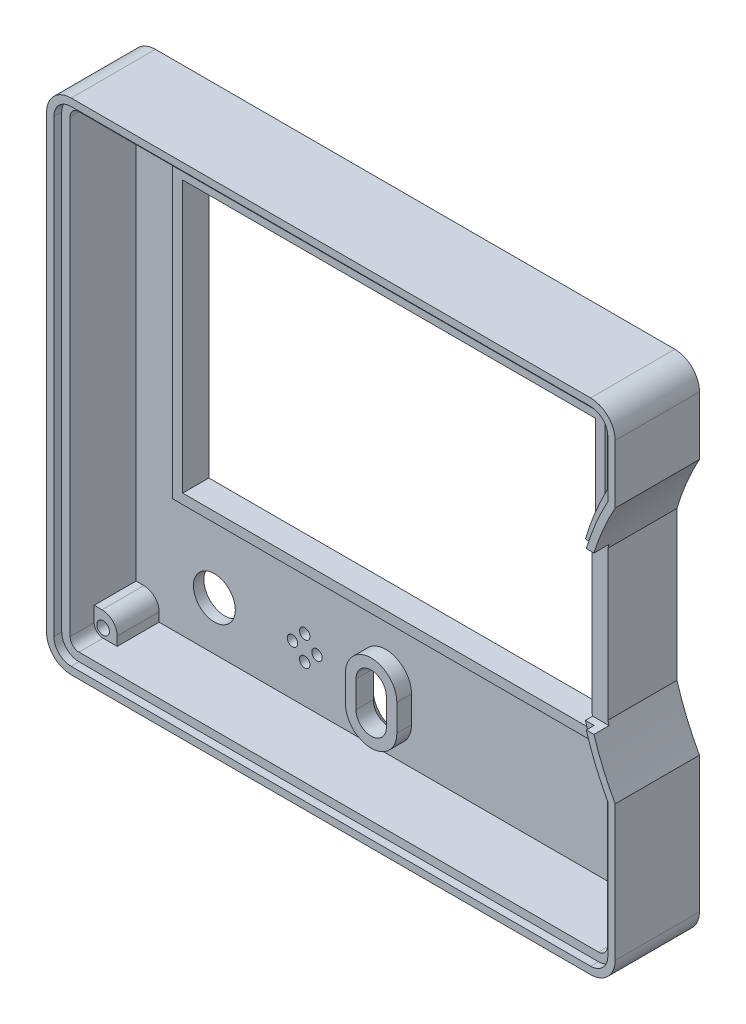
from build123d import *

# Parameters (mm, degrees)
SKETCH1_W                = 108.6
SKETCH1_H                = 95.4
BOSS_EXTRUDE1_DEPTH      = 16.1
CUT_EXTRUDE1_DEPTH       = 75.047214667
FILLET1_R                = 4.7
SHELL1_T                 = -3
SHELL1_THICKNESS_2_DEPTH = 1
CUT_EXTRUDE2_DEPTH       = 1.5
SKETCH4_W                = 78.8
SKETCH4_H                = 51.8
CUT_EXTRUDE3_DEPTH       = 74.63823735
SKETCH5_W                = 82.6
SKETCH5_H                = 55.6
SKETCH5_W_2              = 78.8
SKETCH5_H_2              = 51.8
BOSS_EXTRUDE2_DEPTH      = 3
SKETCH6_R                = 4
SKETCH6_R_2              = 1
CUT_EXTRUDE4_DEPTH       = 74.63823735
BOSS_EXTRUDE3_START      = 2.8
BOSS_EXTRUDE3_DEPTH      = 2.8
CHAMFER1_SIZE            = 1.5
CUT_EXTRUDE5_REACH       = 121.702
SKETCH8_W                = 2.9
SKETCH8_H                = 30
BOSS_EXTRUDE4_START      = 8
BOSS_EXTRUDE4_DEPTH      = 8
FILLET2_R                = 2.9
SKETCH10_R               = 1.21
CUT_EXTRUDE6_DEPTH       = 9


with BuildPart() as part:
    # Sketch1 → Boss-Extrude1 (new body)
    with BuildSketch(Plane.XY):
        Rectangle(SKETCH1_W, SKETCH1_H)
    extrude(amount=BOSS_EXTRUDE1_DEPTH)

    # Sketch2 → Cut-Extrude1 (cut, through all)
    with BuildSketch(Plane.XY.offset(16.1)):
        with BuildLine():
            Line((50.011, -6.861266451), (50.011, 21.582126451))
            ThreePointArc((50.011, 21.582126451), (148.66075, 7.36043), (50.011, -6.861266451))
        make_face()
    extrude(amount=-CUT_EXTRUDE1_DEPTH, mode=Mode.SUBTRACT)

    # Fillet1
    fillet1_edges = [part.edges().sort_by_distance(p)[0] for p in [
        (54.3, -47.7, 8.05),
        (-54.3, -47.7, 8.05),
        (-54.3, 47.7, 8.05),
        (54.3, 47.7, 8.05),
    ]]
    fillet(fillet1_edges, radius=FILLET1_R)

    # Shell1
    shell1_openings = [part.faces().sort_by_distance(p)[0] for p in [
        (-0.877010034, -0.123339484, 16.1),
    ]]
    offset(amount=SHELL1_T, openings=shell1_openings, kind=Kind.INTERSECTION)

    # Shell1 thickness 2 face (on inner face of the shell) → Shell1 thickness 2 (cut)
    with BuildSketch(Plane(origin=(-0.963593996, -0.143755332, 3), x_dir=(-1, 0, 0), z_dir=(0, 0, -1))):
        with BuildLine():
            Line((50.336406004, 43.143755332), (50.336406004, -42.856244668))
            ThreePointArc((50.336406004, -42.856244668), (49.838487532, -44.058326196), (48.636406004, -44.556244668))
            Line((48.636406004, -44.556244668), (-50.563593996, -44.556244668))
            ThreePointArc((-50.563593996, -44.556244668), (-51.765675524, -44.058326196), (-52.263593996, -42.856244668))
            Line((-52.263593996, -42.856244668), (-52.263593996, -17.719055626))
            ThreePointArc((-52.263593996, -17.719055626), (-49.835507324, -12.546349038), (-47.974593996, -7.143618255))
            Line((-47.974593996, -7.143618255), (-47.974593996, 22.151988919))
            ThreePointArc((-47.974593996, 22.151988919), (-49.835507324, 27.554719702), (-52.263593996, 32.72742629))
            Line((-52.263593996, 32.72742629), (-52.263593996, 43.143755332))
            ThreePointArc((-52.263593996, 43.143755332), (-51.765675524, 44.34583686), (-50.563593996, 44.843755332))
            Line((-50.563593996, 44.843755332), (48.636406004, 44.843755332))
            ThreePointArc((48.636406004, 44.843755332), (49.838487532, 44.34583686), (50.336406004, 43.143755332))
        make_face()
    extrude(amount=SHELL1_THICKNESS_2_DEPTH, mode=Mode.SUBTRACT)

    # Sketch3 → Cut-Extrude2 (cut)
    with BuildSketch(Plane.XY.offset(16.1)):
        with BuildLine():
            Line((-51.3, 43), (-51.3, -43))
            ThreePointArc((-51.3, -43), (-50.802081528, -44.202081528), (-49.6, -44.7))
            Line((-49.6, -44.7), (49.6, -44.7))
            ThreePointArc((49.6, -44.7), (50.802081528, -44.202081528), (51.3, -43))
            Line((51.3, -43), (51.3, -17.862810958))
            ThreePointArc((51.3, -17.862810958), (48.786619627, -12.478496653), (46.887595336, -6.84807676))
            Line((46.887595336, -6.84807676), (48.549511715, -6.84807676))
            ThreePointArc((48.549511715, -6.84807676), (50.429997664, -12.273623472), (52.9, -17.457432205))
            Line((52.9, -17.457432205), (52.9, -43))
            ThreePointArc((52.9, -43), (51.933452378, -45.333452378), (49.6, -46.3))
            Line((49.6, -46.3), (-49.6, -46.3))
            ThreePointArc((-49.6, -46.3), (-51.933452378, -45.333452378), (-52.9, -43))
            Line((-52.9, -43), (-52.9, 43))
            ThreePointArc((-52.9, 43), (-51.933452378, 45.333452378), (-49.6, 46.3))
            Line((-49.6, 46.3), (49.6, 46.3))
            ThreePointArc((49.6, 46.3), (51.933452378, 45.333452378), (52.9, 43))
            Line((52.9, 43), (52.9, 32.178292205))
            ThreePointArc((52.9, 32.178292205), (50.429997664, 26.994483472), (48.549511715, 21.56893676))
            Line((48.549511715, 21.56893676), (46.887595336, 21.56893676))
            ThreePointArc((46.887595336, 21.56893676), (48.786619627, 27.199356653), (51.3, 32.583670958))
            Line((51.3, 32.583670958), (51.3, 43))
            ThreePointArc((51.3, 43), (50.802081528, 44.202081528), (49.6, 44.7))
            Line((49.6, 44.7), (-49.6, 44.7))
            ThreePointArc((-49.6, 44.7), (-50.802081528, 44.202081528), (-51.3, 43))
        make_face()
    extrude(amount=-CUT_EXTRUDE2_DEPTH, mode=Mode.SUBTRACT)

    # Sketch4 → Cut-Extrude3 (cut, through all)
    with BuildSketch(Plane.XY.offset(2)):
        with Locations((0, 7.8)):
            Rectangle(SKETCH4_W, SKETCH4_H)
    extrude(amount=-CUT_EXTRUDE3_DEPTH, mode=Mode.SUBTRACT)

    # Sketch5 → Boss-Extrude2 (add)
    with BuildSketch(Plane.XY.offset(2)):
        with Locations((0, 7.8)):
            Rectangle(SKETCH5_W, SKETCH5_H)
        with Locations((0, 7.8)):
            Rectangle(SKETCH5_W_2, SKETCH5_H_2, mode=Mode.SUBTRACT)
    extrude(amount=BOSS_EXTRUDE2_DEPTH)

    # Sketch6 → Cut-Extrude4 (cut, through all)
    with BuildSketch(Plane.XY.offset(2)):
        with Locations((-36.35, -35.4)):
            Circle(SKETCH6_R)
        with Locations((-19.08998, -32.69324)):
            Circle(SKETCH6_R_2)
        with Locations((-19.08998, -37.3744)):
            Circle(SKETCH6_R_2)
        with Locations((-21.43056, -35.03382)):
            Circle(SKETCH6_R_2)
        with Locations((-16.7494, -35.03382)):
            Circle(SKETCH6_R_2)
        with BuildLine():
            Line((-0.7, -32.46283), (-0.7, -37.6))
            ThreePointArc((-0.7, -37.6), (-3.6, -40.5), (-6.5, -37.6))
            Line((-6.5, -37.6), (-6.5, -32.46283))
            ThreePointArc((-6.5, -32.46283), (-3.6, -29.56283), (-0.7, -32.46283))
        make_face()
    extrude(amount=-CUT_EXTRUDE4_DEPTH, mode=Mode.SUBTRACT)

    # Sketch7 → Boss-Extrude3 (add)
    with BuildSketch(Plane.XY.offset(2).offset(BOSS_EXTRUDE3_START)):
        with BuildLine():
            Line((-8.5, -32.46283), (-8.5, -37.6))
            ThreePointArc((-8.5, -37.6), (-3.6, -42.5), (1.3, -37.6))
            Line((1.3, -37.6), (1.3, -32.46283))
            ThreePointArc((1.3, -32.46283), (-3.6, -27.56283), (-8.5, -32.46283))
        make_face()
        with BuildLine():
            Line((-6.5, -32.46283), (-6.5, -37.6))
            ThreePointArc((-6.5, -37.6), (-3.6, -40.5), (-0.7, -37.6))
            Line((-0.7, -37.6), (-0.7, -32.46283))
            ThreePointArc((-0.7, -32.46283), (-3.6, -29.56283), (-6.5, -32.46283))
        make_face(mode=Mode.SUBTRACT)
    extrude(amount=-BOSS_EXTRUDE3_DEPTH)

    # Chamfer1
    chamfer1_edges = [part.edges().sort_by_distance(p)[0] for p in [
        (-3.6, -29.56283, 0),
        (-0.7, -35.031415, 0),
        (-3.6, -40.5, 0),
        (-6.5, -35.031415, 0),
    ]]
    chamfer(chamfer1_edges, length=CHAMFER1_SIZE)

    # Sketch8 → Cut-Extrude5 (cut, up to next)
    with BuildSketch(Plane(origin=(54.3, 0, 0), x_dir=(0, 0, -1), z_dir=(1, 0, 0)), mode=Mode.PRIVATE) as cut_extrude5_sk1:
        with Locations((-14.65, 7.36043)):
            Rectangle(SKETCH8_W, SKETCH8_H)
    cut_extrude5_tool1 = extrude(cut_extrude5_sk1.sketch, amount=-CUT_EXTRUDE5_REACH, mode=Mode.PRIVATE) & part.part
    add(cut_extrude5_tool1.solids().sort_by_distance((54.3, 7.36043, 14.65))[0], mode=Mode.SUBTRACT)

    # Sketch9 → Boss-Extrude4 (add)
    with BuildSketch(Plane.XY.offset(2).offset(BOSS_EXTRUDE4_START)):
        with BuildLine():
            Line((49.6, 44.7), (46.9, 44.7))
            Line((46.9, 44.7), (46.9, 40.1))
            Line((46.9, 40.1), (51.3, 40.1))
            Line((51.3, 40.1), (51.3, 43))
            ThreePointArc((51.3, 43), (50.802081528, 44.202081528), (49.6, 44.7))
        make_face()
        with BuildLine():
            Line((-51.3, 40.1), (-46.9, 40.1))
            Line((-46.9, 40.1), (-46.9, 44.7))
            Line((-46.9, 44.7), (-49.6, 44.7))
            ThreePointArc((-49.6, 44.7), (-50.802081528, 44.202081528), (-51.3, 43))
            Line((-51.3, 43), (-51.3, 40.1))
        make_face()
        with BuildLine():
            Line((-51.3, -43), (-51.3, -40.1))
            Line((-51.3, -40.1), (-46.9, -40.1))
            Line((-46.9, -40.1), (-46.9, -44.7))
            Line((-46.9, -44.7), (-49.6, -44.7))
            ThreePointArc((-49.6, -44.7), (-50.802081528, -44.202081528), (-51.3, -43))
        make_face()
        with BuildLine():
            Line((49.6, -44.7), (46.9, -44.7))
            Line((46.9, -44.7), (46.9, -40.1))
            Line((46.9, -40.1), (51.3, -40.1))
            Line((51.3, -40.1), (51.3, -43))
            ThreePointArc((51.3, -43), (50.802081528, -44.202081528), (49.6, -44.7))
        make_face()
    extrude(amount=-BOSS_EXTRUDE4_DEPTH)

    # Fillet2
    fillet2_edges = [part.edges().sort_by_distance(p)[0] for p in [
        (-46.9, 40.1, 6),
        (46.9, 40.1, 6),
        (46.9, -40.1, 6),
        (-46.9, -40.1, 6),
    ]]
    fillet(fillet2_edges, radius=FILLET2_R)

    # Sketch10 → Cut-Extrude6 (cut)
    with BuildSketch(Plane.XY.offset(10)):
        with Locations((-49.6, 43)):
            Circle(SKETCH10_R)
        with Locations((49.6, 43)):
            Circle(SKETCH10_R)
        with Locations((49.6, -43)):
            Circle(SKETCH10_R)
        with Locations((-49.6, -43)):
            Circle(SKETCH10_R)
    extrude(amount=-CUT_EXTRUDE6_DEPTH, mode=Mode.SUBTRACT)


solid = part.part
